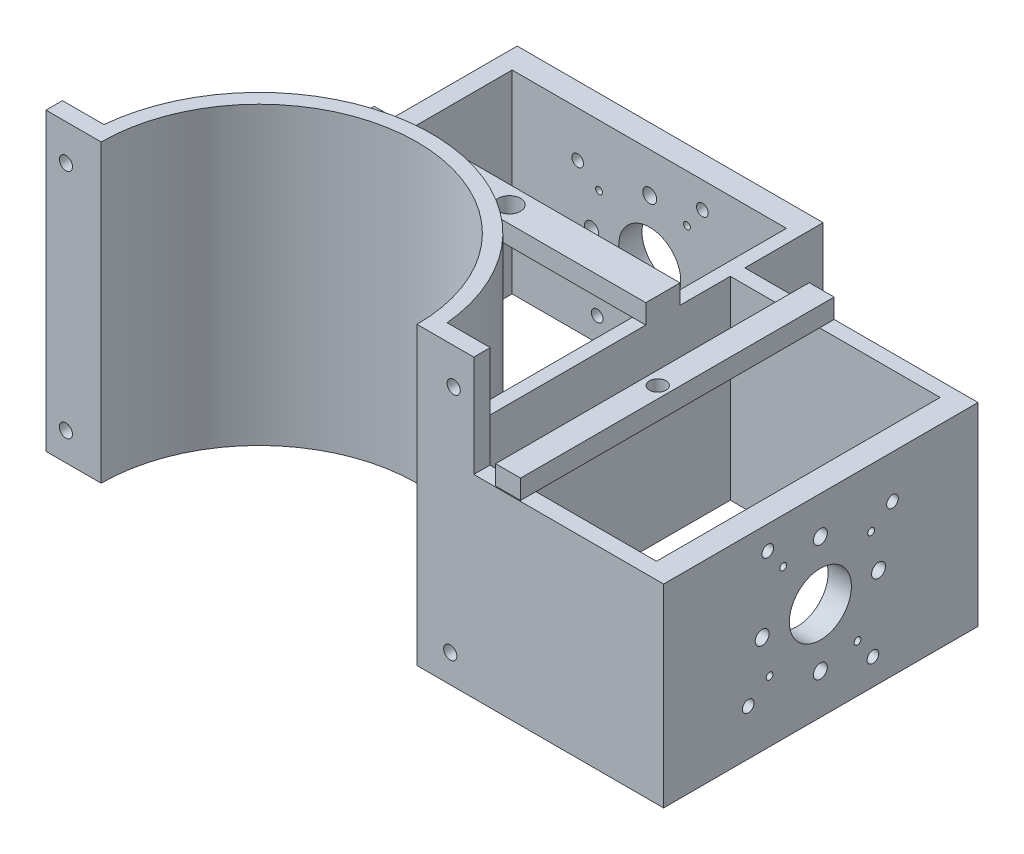
from build123d import *

# Parameters (mm, degrees)
BOSS_EXTRUDE1_DEPTH            = 76.2
M3_CLEARANCE_HOLE1_D           = 3.4
M3_CLEARANCE_HOLE1_CSINK_D     = 3.45
M3_CLEARANCE_HOLE1_CSINK_ANGLE = 90
BOSS_EXTRUDE2_DEPTH            = 50
CUT_EXTRUDE1_REACH             = 140.285
SKETCH6_R                      = 8
SKETCH6_R_2                    = 0.875
SKETCH6_R_3                    = 1.8
SKETCH6_R_4                    = 1.5
SKETCH8_W                      = 57.573925352
SKETCH8_H                      = 3.755504354
SKETCH8_W_2                    = 42.931192533
SKETCH8_H_2                    = 4.158956093
BOSS_EXTRUDE4_DEPTH            = 50
BOSS_EXTRUDE5_DEPTH            = 50
CUT_EXTRUDE2_REACH             = 205.498
SKETCH9_R                      = 8
SKETCH9_R_2                    = 0.875
SKETCH9_R_3                    = 1.8
SKETCH9_R_4                    = 1.5
SKETCH11_W                     = 78.871459379
SKETCH11_H                     = 8.833029297
SKETCH11_R                     = 2.899037526
BOSS_EXTRUDE6_DEPTH            = 5
SKETCH13_W                     = 6.435110791
SKETCH13_H                     = 80.84633132
SKETCH13_R                     = 2.126470016
BOSS_EXTRUDE9_DEPTH            = 5


with BuildPart() as part:
    # Sketch1 → Boss-Extrude1 (new body)
    with BuildSketch(Plane(origin=(0, 0, 0), x_dir=(1, 0, 0), z_dir=(0, 1, 0))):
        with BuildLine():
            ThreePointArc((-40.716846583, 0), (0, 40.716846583), (40.716846583, 0))
            Line((40.716846583, 0), (55.359579402, 0))
            Line((55.359579402, 0), (55.359579402, 4.24119048))
            Line((55.359579402, 4.24119048), (44.247201079, 4.24119048))
            ThreePointArc((44.247201079, 4.24119048), (0, 44.45), (-44.247201079, 4.24119048))
            Line((-44.247201079, 4.24119048), (-54.936217795, 4.24119048))
            Line((-54.936217795, 4.24119048), (-54.936217795, 0))
            Line((-54.936217795, 0), (-40.716846583, 0))
        make_face()
    extrude(amount=BOSS_EXTRUDE1_DEPTH)

    # M3 Clearance Hole1 (through all)
    with Locations(Plane(origin=(50.171881224, 66.945390665, -4.24119048), x_dir=(-1, 0, 0), z_dir=(0, 0, -1))):
        with Locations((0, 0), (0.880500078, -59.713914359), (99.976781548, -59.713914359), (99.976781548, 0)):
            CounterSinkHole(M3_CLEARANCE_HOLE1_D / 2, M3_CLEARANCE_HOLE1_CSINK_D / 2, counter_sink_angle=M3_CLEARANCE_HOLE1_CSINK_ANGLE)

    # Sketch5 → Boss-Extrude2 (add)
    with BuildSketch(Plane.XZ):
        Polygon((-30, -27.529286146), (-34.697584749, -27.529286146), (-34.697584749, -101.25), (44.17387463, -101.25), (44.17387463, 0), (40.716846583, 0), (40.716846583, -95.25), (-30, -95.25), align=None)
    extrude(amount=-BOSS_EXTRUDE2_DEPTH)

    # Sketch6 → Cut-Extrude1 (cut, up to next)
    with BuildSketch(Plane(origin=(0, 0, -101.25), x_dir=(-1, 0, 0), z_dir=(0, 0, -1)), mode=Mode.PRIVATE) as cut_extrude1_sk1:
        with Locations((-5.474490166, 24.622467849)):
            Circle(SKETCH6_R)
    cut_extrude1_tool1 = extrude(cut_extrude1_sk1.sketch, amount=-CUT_EXTRUDE1_REACH, mode=Mode.PRIVATE) & part.part
    # Sketch6 → Cut-Extrude1 (cut, up to next)
    with BuildSketch(Plane(origin=(0, 0, -101.25), x_dir=(-1, 0, 0), z_dir=(0, 0, -1)), mode=Mode.PRIVATE) as cut_extrude1_sk2:
        with Locations((-15.066285044, 37.777193582)):
            Circle(SKETCH6_R_2)
    cut_extrude1_tool2 = extrude(cut_extrude1_sk2.sketch, amount=-CUT_EXTRUDE1_REACH, mode=Mode.PRIVATE) & part.part
    # Sketch6 → Cut-Extrude1 (cut, up to next)
    with BuildSketch(Plane(origin=(0, 0, -101.25), x_dir=(-1, 0, 0), z_dir=(0, 0, -1)), mode=Mode.PRIVATE) as cut_extrude1_sk3:
        with Locations((7.604632911, 34.283445011)):
            Circle(SKETCH6_R_2)
    cut_extrude1_tool3 = extrude(cut_extrude1_sk3.sketch, amount=-CUT_EXTRUDE1_REACH, mode=Mode.PRIVATE) & part.part
    # Sketch6 → Cut-Extrude1 (cut, up to next)
    with BuildSketch(Plane(origin=(0, 0, -101.25), x_dir=(-1, 0, 0), z_dir=(0, 0, -1)), mode=Mode.PRIVATE) as cut_extrude1_sk4:
        with Locations((4.11088434, 11.612527056)):
            Circle(SKETCH6_R_2)
    cut_extrude1_tool4 = extrude(cut_extrude1_sk4.sketch, amount=-CUT_EXTRUDE1_REACH, mode=Mode.PRIVATE) & part.part
    # Sketch6 → Cut-Extrude1 (cut, up to next)
    with BuildSketch(Plane(origin=(0, 0, -101.25), x_dir=(-1, 0, 0), z_dir=(0, 0, -1)), mode=Mode.PRIVATE) as cut_extrude1_sk5:
        with Locations((-18.560033615, 15.106275627)):
            Circle(SKETCH6_R_2)
    cut_extrude1_tool5 = extrude(cut_extrude1_sk5.sketch, amount=-CUT_EXTRUDE1_REACH, mode=Mode.PRIVATE) & part.part
    # Sketch6 → Cut-Extrude1 (cut, up to next)
    with BuildSketch(Plane(origin=(0, 0, -101.25), x_dir=(-1, 0, 0), z_dir=(0, 0, -1)), mode=Mode.PRIVATE) as cut_extrude1_sk6:
        with Locations((-5.474490166, 39.694860319)):
            Circle(SKETCH6_R_3)
    cut_extrude1_tool6 = extrude(cut_extrude1_sk6.sketch, amount=-CUT_EXTRUDE1_REACH, mode=Mode.PRIVATE) & part.part
    # Sketch6 → Cut-Extrude1 (cut, up to next)
    with BuildSketch(Plane(origin=(0, 0, -101.25), x_dir=(-1, 0, 0), z_dir=(0, 0, -1)), mode=Mode.PRIVATE) as cut_extrude1_sk7:
        with Locations((9.522299648, 24.691650133)):
            Circle(SKETCH6_R_3)
    cut_extrude1_tool7 = extrude(cut_extrude1_sk7.sketch, amount=-CUT_EXTRUDE1_REACH, mode=Mode.PRIVATE) & part.part
    # Sketch6 → Cut-Extrude1 (cut, up to next)
    with BuildSketch(Plane(origin=(0, 0, -101.25), x_dir=(-1, 0, 0), z_dir=(0, 0, -1)), mode=Mode.PRIVATE) as cut_extrude1_sk8:
        with Locations((-5.480910537, 9.694860319)):
            Circle(SKETCH6_R_3)
    cut_extrude1_tool8 = extrude(cut_extrude1_sk8.sketch, amount=-CUT_EXTRUDE1_REACH, mode=Mode.PRIVATE) & part.part
    # Sketch6 → Cut-Extrude1 (cut, up to next)
    with BuildSketch(Plane(origin=(0, 0, -101.25), x_dir=(-1, 0, 0), z_dir=(0, 0, -1)), mode=Mode.PRIVATE) as cut_extrude1_sk9:
        with Locations((-20.477700352, 24.698070504)):
            Circle(SKETCH6_R_3)
    cut_extrude1_tool9 = extrude(cut_extrude1_sk9.sketch, amount=-CUT_EXTRUDE1_REACH, mode=Mode.PRIVATE) & part.part
    # Sketch6 → Cut-Extrude1 (cut, up to next)
    with BuildSketch(Plane(origin=(0, 0, -101.25), x_dir=(-1, 0, 0), z_dir=(0, 0, -1)), mode=Mode.PRIVATE) as cut_extrude1_sk10:
        with Locations((-19.037624155, 43.284872865)):
            Circle(SKETCH6_R_4)
    cut_extrude1_tool10 = extrude(cut_extrude1_sk10.sketch, amount=-CUT_EXTRUDE1_REACH, mode=Mode.PRIVATE) & part.part
    # Sketch6 → Cut-Extrude1 (cut, up to next)
    with BuildSketch(Plane(origin=(0, 0, -101.25), x_dir=(-1, 0, 0), z_dir=(0, 0, -1)), mode=Mode.PRIVATE) as cut_extrude1_sk11:
        with Locations((13.112312194, 38.254784122)):
            Circle(SKETCH6_R_4)
    cut_extrude1_tool11 = extrude(cut_extrude1_sk11.sketch, amount=-CUT_EXTRUDE1_REACH, mode=Mode.PRIVATE) & part.part
    # Sketch6 → Cut-Extrude1 (cut, up to next)
    with BuildSketch(Plane(origin=(0, 0, -101.25), x_dir=(-1, 0, 0), z_dir=(0, 0, -1)), mode=Mode.PRIVATE) as cut_extrude1_sk12:
        with Locations((8.082223451, 6.104847773)):
            Circle(SKETCH6_R_4)
    cut_extrude1_tool12 = extrude(cut_extrude1_sk12.sketch, amount=-CUT_EXTRUDE1_REACH, mode=Mode.PRIVATE) & part.part
    # Sketch6 → Cut-Extrude1 (cut, up to next)
    with BuildSketch(Plane(origin=(0, 0, -101.25), x_dir=(-1, 0, 0), z_dir=(0, 0, -1)), mode=Mode.PRIVATE) as cut_extrude1_sk13:
        with Locations((-24.067712897, 11.134936516)):
            Circle(SKETCH6_R_4)
    cut_extrude1_tool13 = extrude(cut_extrude1_sk13.sketch, amount=-CUT_EXTRUDE1_REACH, mode=Mode.PRIVATE) & part.part
    add(cut_extrude1_tool1.solids().sort_by_distance((5.47449, 24.622468, -101.25))[0], mode=Mode.SUBTRACT)
    add(cut_extrude1_tool2.solids().sort_by_distance((15.066285, 37.777194, -101.25))[0], mode=Mode.SUBTRACT)
    add(cut_extrude1_tool3.solids().sort_by_distance((-7.604633, 34.283445, -101.25))[0], mode=Mode.SUBTRACT)
    add(cut_extrude1_tool4.solids().sort_by_distance((-4.110884, 11.612527, -101.25))[0], mode=Mode.SUBTRACT)
    add(cut_extrude1_tool5.solids().sort_by_distance((18.560034, 15.106276, -101.25))[0], mode=Mode.SUBTRACT)
    add(cut_extrude1_tool6.solids().sort_by_distance((5.47449, 39.69486, -101.25))[0], mode=Mode.SUBTRACT)
    add(cut_extrude1_tool7.solids().sort_by_distance((-9.5223, 24.69165, -101.25))[0], mode=Mode.SUBTRACT)
    add(cut_extrude1_tool8.solids().sort_by_distance((5.480911, 9.69486, -101.25))[0], mode=Mode.SUBTRACT)
    add(cut_extrude1_tool9.solids().sort_by_distance((20.4777, 24.698071, -101.25))[0], mode=Mode.SUBTRACT)
    add(cut_extrude1_tool10.solids().sort_by_distance((19.037624, 43.284873, -101.25))[0], mode=Mode.SUBTRACT)
    add(cut_extrude1_tool11.solids().sort_by_distance((-13.112312, 38.254784, -101.25))[0], mode=Mode.SUBTRACT)
    add(cut_extrude1_tool12.solids().sort_by_distance((-8.082223, 6.104848, -101.25))[0], mode=Mode.SUBTRACT)
    add(cut_extrude1_tool13.solids().sort_by_distance((24.067713, 11.134937, -101.25))[0], mode=Mode.SUBTRACT)

    # Sketch8 → Boss-Extrude4 (add)
    with BuildSketch(Plane.XZ):
        with Locations((69.503809259, -79.186803569)):
            Rectangle(SKETCH8_W, SKETCH8_H)
        with Locations((76.825175669, -2.079478047)):
            Rectangle(SKETCH8_W_2, SKETCH8_H_2)
    extrude(amount=-BOSS_EXTRUDE4_DEPTH)

    # Sketch8<3> → Boss-Extrude5 (add)
    with BuildSketch(Plane.XZ):
        Polygon((98.290771935, -4.158956093), (98.290771935, -77.309051392), (98.290771935, -81.064555746), (104.290771935, -81.064555746), (104.290771935, 0), (98.290771935, 0), align=None)
    extrude(amount=-BOSS_EXTRUDE5_DEPTH)

    # Sketch9 → Cut-Extrude2 (cut, up to next)
    with BuildSketch(Plane(origin=(104.290771935, 0, 0), x_dir=(0, 0, -1), z_dir=(1, 0, 0)), mode=Mode.PRIVATE) as cut_extrude2_sk1:
        with Locations((40.426560471, 25.290112626)):
            Circle(SKETCH9_R)
    cut_extrude2_tool1 = extrude(cut_extrude2_sk1.sketch, amount=-CUT_EXTRUDE2_REACH, mode=Mode.PRIVATE) & part.part
    # Sketch9 → Cut-Extrude2 (cut, up to next)
    with BuildSketch(Plane(origin=(104.290771935, 0, 0), x_dir=(0, 0, -1), z_dir=(1, 0, 0)), mode=Mode.PRIVATE) as cut_extrude2_sk2:
        with Locations((30.834765593, 38.444838359)):
            Circle(SKETCH9_R_2)
    cut_extrude2_tool2 = extrude(cut_extrude2_sk2.sketch, amount=-CUT_EXTRUDE2_REACH, mode=Mode.PRIVATE) & part.part
    # Sketch9 → Cut-Extrude2 (cut, up to next)
    with BuildSketch(Plane(origin=(104.290771935, 0, 0), x_dir=(0, 0, -1), z_dir=(1, 0, 0)), mode=Mode.PRIVATE) as cut_extrude2_sk3:
        with Locations((53.505683549, 34.951089788)):
            Circle(SKETCH9_R_2)
    cut_extrude2_tool3 = extrude(cut_extrude2_sk3.sketch, amount=-CUT_EXTRUDE2_REACH, mode=Mode.PRIVATE) & part.part
    # Sketch9 → Cut-Extrude2 (cut, up to next)
    with BuildSketch(Plane(origin=(104.290771935, 0, 0), x_dir=(0, 0, -1), z_dir=(1, 0, 0)), mode=Mode.PRIVATE) as cut_extrude2_sk4:
        with Locations((50.011934978, 12.280171833)):
            Circle(SKETCH9_R_2)
    cut_extrude2_tool4 = extrude(cut_extrude2_sk4.sketch, amount=-CUT_EXTRUDE2_REACH, mode=Mode.PRIVATE) & part.part
    # Sketch9 → Cut-Extrude2 (cut, up to next)
    with BuildSketch(Plane(origin=(104.290771935, 0, 0), x_dir=(0, 0, -1), z_dir=(1, 0, 0)), mode=Mode.PRIVATE) as cut_extrude2_sk5:
        with Locations((27.341017023, 15.773920404)):
            Circle(SKETCH9_R_2)
    cut_extrude2_tool5 = extrude(cut_extrude2_sk5.sketch, amount=-CUT_EXTRUDE2_REACH, mode=Mode.PRIVATE) & part.part
    # Sketch9 → Cut-Extrude2 (cut, up to next)
    with BuildSketch(Plane(origin=(104.290771935, 0, 0), x_dir=(0, 0, -1), z_dir=(1, 0, 0)), mode=Mode.PRIVATE) as cut_extrude2_sk6:
        with Locations((40.426560471, 40.362505096)):
            Circle(SKETCH9_R_3)
    cut_extrude2_tool6 = extrude(cut_extrude2_sk6.sketch, amount=-CUT_EXTRUDE2_REACH, mode=Mode.PRIVATE) & part.part
    # Sketch9 → Cut-Extrude2 (cut, up to next)
    with BuildSketch(Plane(origin=(104.290771935, 0, 0), x_dir=(0, 0, -1), z_dir=(1, 0, 0)), mode=Mode.PRIVATE) as cut_extrude2_sk7:
        with Locations((55.423350286, 25.359294911)):
            Circle(SKETCH9_R_3)
    cut_extrude2_tool7 = extrude(cut_extrude2_sk7.sketch, amount=-CUT_EXTRUDE2_REACH, mode=Mode.PRIVATE) & part.part
    # Sketch9 → Cut-Extrude2 (cut, up to next)
    with BuildSketch(Plane(origin=(104.290771935, 0, 0), x_dir=(0, 0, -1), z_dir=(1, 0, 0)), mode=Mode.PRIVATE) as cut_extrude2_sk8:
        with Locations((40.4201401, 10.362505096)):
            Circle(SKETCH9_R_3)
    cut_extrude2_tool8 = extrude(cut_extrude2_sk8.sketch, amount=-CUT_EXTRUDE2_REACH, mode=Mode.PRIVATE) & part.part
    # Sketch9 → Cut-Extrude2 (cut, up to next)
    with BuildSketch(Plane(origin=(104.290771935, 0, 0), x_dir=(0, 0, -1), z_dir=(1, 0, 0)), mode=Mode.PRIVATE) as cut_extrude2_sk9:
        with Locations((25.423350286, 25.365715282)):
            Circle(SKETCH9_R_3)
    cut_extrude2_tool9 = extrude(cut_extrude2_sk9.sketch, amount=-CUT_EXTRUDE2_REACH, mode=Mode.PRIVATE) & part.part
    # Sketch9 → Cut-Extrude2 (cut, up to next)
    with BuildSketch(Plane(origin=(104.290771935, 0, 0), x_dir=(0, 0, -1), z_dir=(1, 0, 0)), mode=Mode.PRIVATE) as cut_extrude2_sk10:
        with Locations((59.013362831, 38.922428899)):
            Circle(SKETCH9_R_4)
    cut_extrude2_tool10 = extrude(cut_extrude2_sk10.sketch, amount=-CUT_EXTRUDE2_REACH, mode=Mode.PRIVATE) & part.part
    # Sketch9 → Cut-Extrude2 (cut, up to next)
    with BuildSketch(Plane(origin=(104.290771935, 0, 0), x_dir=(0, 0, -1), z_dir=(1, 0, 0)), mode=Mode.PRIVATE) as cut_extrude2_sk11:
        with Locations((53.983274089, 6.77249255)):
            Circle(SKETCH9_R_4)
    cut_extrude2_tool11 = extrude(cut_extrude2_sk11.sketch, amount=-CUT_EXTRUDE2_REACH, mode=Mode.PRIVATE) & part.part
    # Sketch9 → Cut-Extrude2 (cut, up to next)
    with BuildSketch(Plane(origin=(104.290771935, 0, 0), x_dir=(0, 0, -1), z_dir=(1, 0, 0)), mode=Mode.PRIVATE) as cut_extrude2_sk12:
        with Locations((26.863426483, 43.952517642)):
            Circle(SKETCH9_R_4)
    cut_extrude2_tool12 = extrude(cut_extrude2_sk12.sketch, amount=-CUT_EXTRUDE2_REACH, mode=Mode.PRIVATE) & part.part
    # Sketch9 → Cut-Extrude2 (cut, up to next)
    with BuildSketch(Plane(origin=(104.290771935, 0, 0), x_dir=(0, 0, -1), z_dir=(1, 0, 0)), mode=Mode.PRIVATE) as cut_extrude2_sk13:
        with Locations((21.83333774, 11.802581293)):
            Circle(SKETCH9_R_4)
    cut_extrude2_tool13 = extrude(cut_extrude2_sk13.sketch, amount=-CUT_EXTRUDE2_REACH, mode=Mode.PRIVATE) & part.part
    add(cut_extrude2_tool1.solids().sort_by_distance((104.290772, 25.290113, -40.42656))[0], mode=Mode.SUBTRACT)
    add(cut_extrude2_tool2.solids().sort_by_distance((104.290772, 38.444838, -30.834766))[0], mode=Mode.SUBTRACT)
    add(cut_extrude2_tool3.solids().sort_by_distance((104.290772, 34.95109, -53.505684))[0], mode=Mode.SUBTRACT)
    add(cut_extrude2_tool4.solids().sort_by_distance((104.290772, 12.280172, -50.011935))[0], mode=Mode.SUBTRACT)
    add(cut_extrude2_tool5.solids().sort_by_distance((104.290772, 15.77392, -27.341017))[0], mode=Mode.SUBTRACT)
    add(cut_extrude2_tool6.solids().sort_by_distance((104.290772, 40.362505, -40.42656))[0], mode=Mode.SUBTRACT)
    add(cut_extrude2_tool7.solids().sort_by_distance((104.290772, 25.359295, -55.42335))[0], mode=Mode.SUBTRACT)
    add(cut_extrude2_tool8.solids().sort_by_distance((104.290772, 10.362505, -40.42014))[0], mode=Mode.SUBTRACT)
    add(cut_extrude2_tool9.solids().sort_by_distance((104.290772, 25.365715, -25.42335))[0], mode=Mode.SUBTRACT)
    add(cut_extrude2_tool10.solids().sort_by_distance((104.290772, 38.922429, -59.013363))[0], mode=Mode.SUBTRACT)
    add(cut_extrude2_tool11.solids().sort_by_distance((104.290772, 6.772493, -53.983274))[0], mode=Mode.SUBTRACT)
    add(cut_extrude2_tool12.solids().sort_by_distance((104.290772, 43.952518, -26.863426))[0], mode=Mode.SUBTRACT)
    add(cut_extrude2_tool13.solids().sort_by_distance((104.290772, 11.802581, -21.833338))[0], mode=Mode.SUBTRACT)

    # Sketch11 → Boss-Extrude6 (add)
    with BuildSketch(Plane(origin=(0, 50, 0), x_dir=(1, 0, 0), z_dir=(0, 1, 0))):
        with Locations((4.73814494, 59.948753147)):
            Rectangle(SKETCH11_W, SKETCH11_H)
        with Locations((4.738144941, 59.78517853)):
            Circle(SKETCH11_R, mode=Mode.SUBTRACT)
    extrude(amount=BOSS_EXTRUDE6_DEPTH)

    # Sketch13 → Boss-Extrude9 (add)
    with BuildSketch(Plane(origin=(0, 50, 0), x_dir=(1, 0, 0), z_dir=(0, 1, 0))):
        with Locations((63.984854455, 40.641390086)):
            Rectangle(SKETCH13_W, SKETCH13_H)
        with Locations((64.209206258, 38.579730756)):
            Circle(SKETCH13_R, mode=Mode.SUBTRACT)
    extrude(amount=BOSS_EXTRUDE9_DEPTH)


solid = part.part
